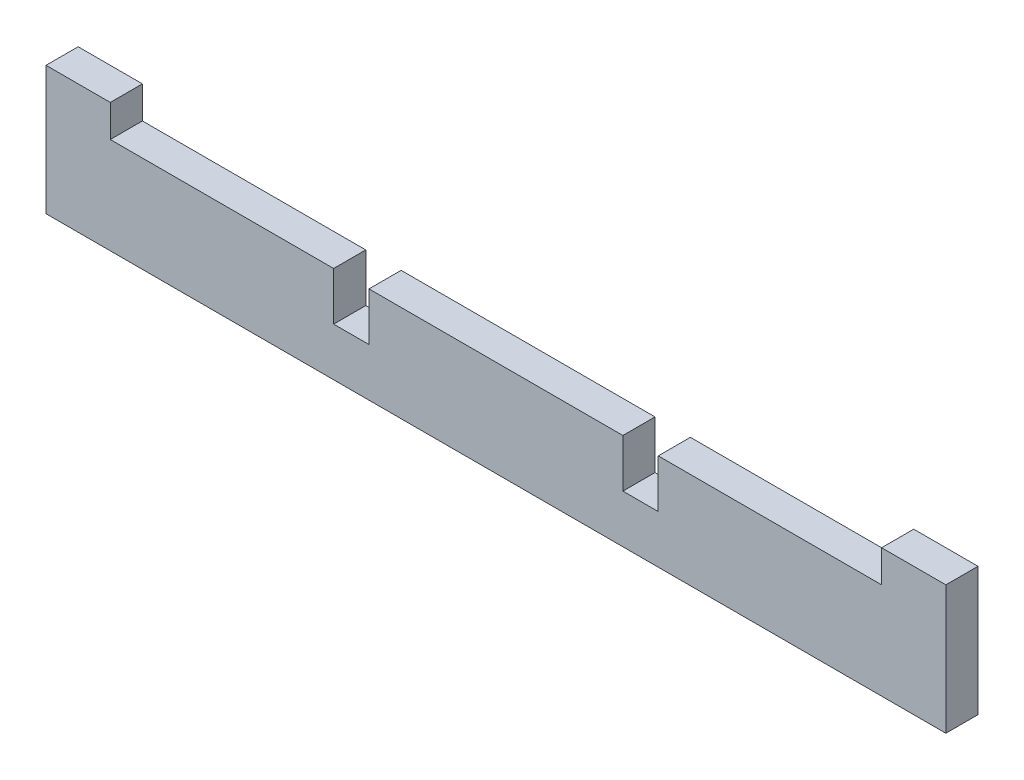
from build123d import *

# Parameters (mm, degrees)
BOSS_EXTRUDE1_DEPTH = 2.5


with BuildPart() as part:
    # Sketch2 → Boss-Extrude1 (new, symmetric)
    with BuildSketch(Plane.XY):
        Polygon((673.280484652, -183.645557825), (673.280484652, -203.645557825), (533.280484652, -203.645557825), (533.280484652, -183.645557825), (543.280484652, -183.645557825), (543.280484652, -188.645557825), (578.030484652, -188.645557825), (578.030484652, -196.145557825), (583.530484652, -196.145557825), (583.530484652, -188.645557825), (623.030484652, -188.645557825), (623.030484652, -196.145557825), (628.530484652, -196.145557825), (628.530484652, -188.645557825), (663.280484652, -188.645557825), (663.280484652, -183.645557825), align=None)
    extrude(amount=BOSS_EXTRUDE1_DEPTH, both=True)


solid = part.part
